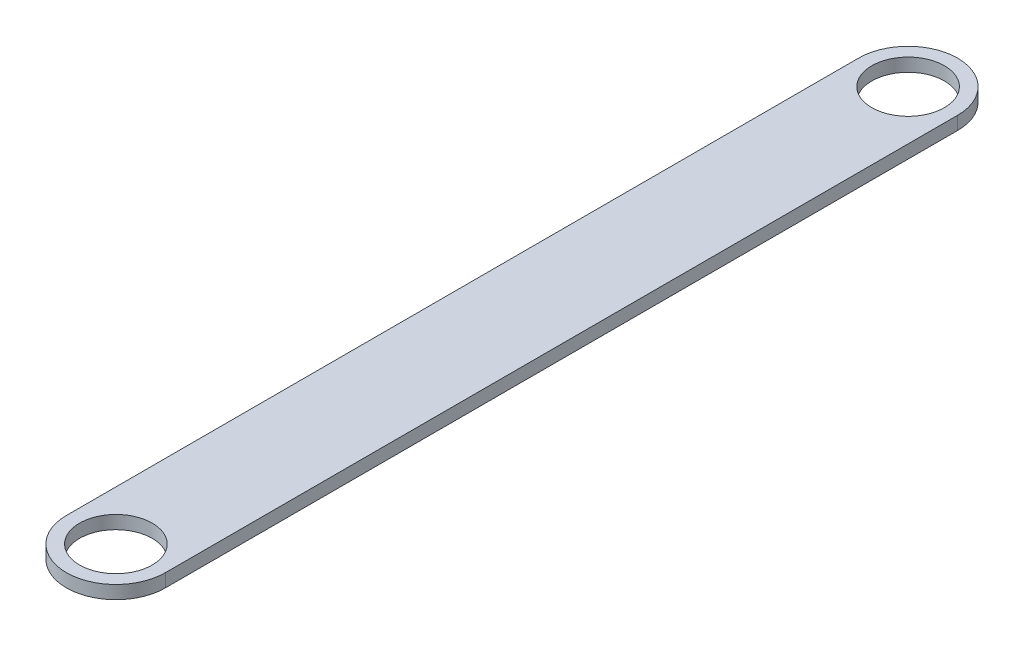
from build123d import *

# Parameters (mm, degrees)
SKETCH1_R           = 5.5
BOSS_EXTRUDE1_DEPTH = 2


with BuildPart() as part:
    # Sketch1 → Boss-Extrude1 (new body)
    with BuildSketch(Plane(origin=(0, 0, 0), x_dir=(1, 0, 0), z_dir=(0, 1, 0))):
        with BuildLine():
            Line((-7.5, 0), (-7.5, 120))
            ThreePointArc((-7.5, 120), (0, 127.5), (7.5, 120))
            Line((7.5, 120), (7.5, 0))
            ThreePointArc((7.5, 0), (0, -7.5), (-7.5, 0))
        make_face()
        with Locations(Location((0, 120, 0), (0, 0, 270))):
            Circle(SKETCH1_R, mode=Mode.SUBTRACT)
        with Locations(Location((0, 0, 0), (0, 0, 270))):
            Circle(SKETCH1_R, mode=Mode.SUBTRACT)
    extrude(amount=BOSS_EXTRUDE1_DEPTH)


solid = part.part
